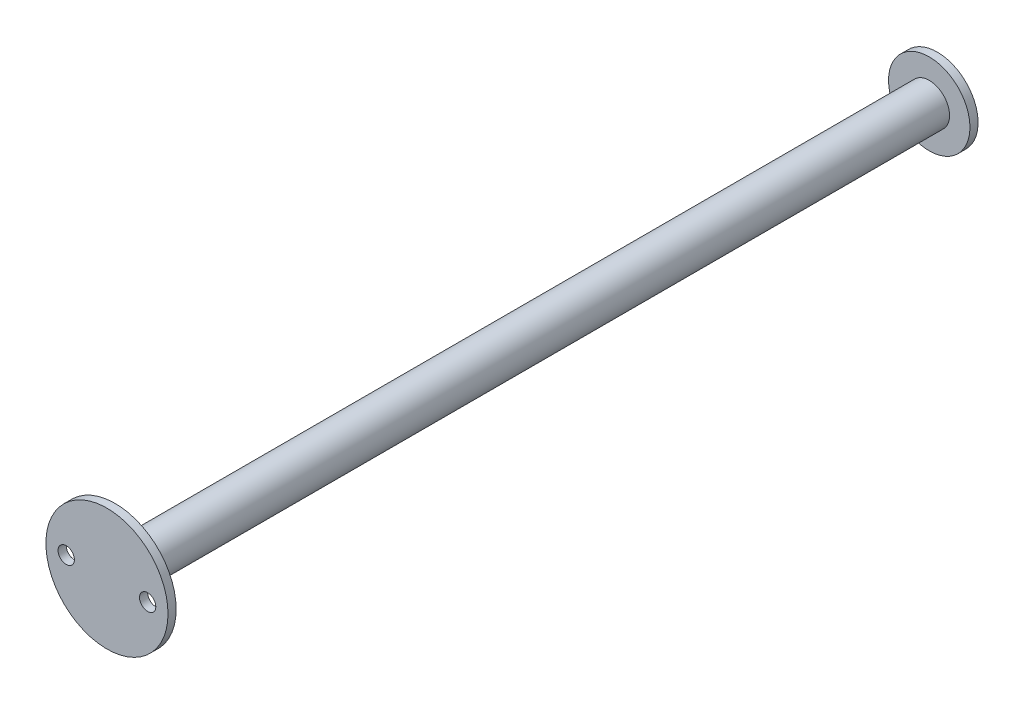
from build123d import *

# Parameters (mm, degrees)
SKETCH_1_R      = 5
EXTRUDE_1_DEPTH = 100
SKETCH_2_R      = 10
EXTRUDE_2_DEPTH = 2
SKETCH_3_R      = 15
SKETCH_3_R_2    = 2
EXTRUDE_3_DEPTH = 2


with BuildPart() as part:
    # 草图1 → 凸台-拉伸1 (new, symmetric)
    with BuildSketch(Plane.XY):
        Circle(SKETCH_1_R)
    extrude(amount=EXTRUDE_1_DEPTH, both=True)

    # 草图2 → 凸台-拉伸2 (add)
    with BuildSketch(Plane(origin=(0, 0, -100), x_dir=(-1, 0, 0), z_dir=(0, 0, -1))):
        Circle(SKETCH_2_R)
    extrude(amount=EXTRUDE_2_DEPTH)

    # 草图3 → 凸台-拉伸3 (add)
    with BuildSketch(Plane.XY.offset(100)):
        Circle(SKETCH_3_R)
        with Locations((-10, 0)):
            Circle(SKETCH_3_R_2, mode=Mode.SUBTRACT)
        with Locations(Location((10, 0, 0), (0, 0, 180))):
            Circle(SKETCH_3_R_2, mode=Mode.SUBTRACT)
    extrude(amount=EXTRUDE_3_DEPTH)


solid = part.part
